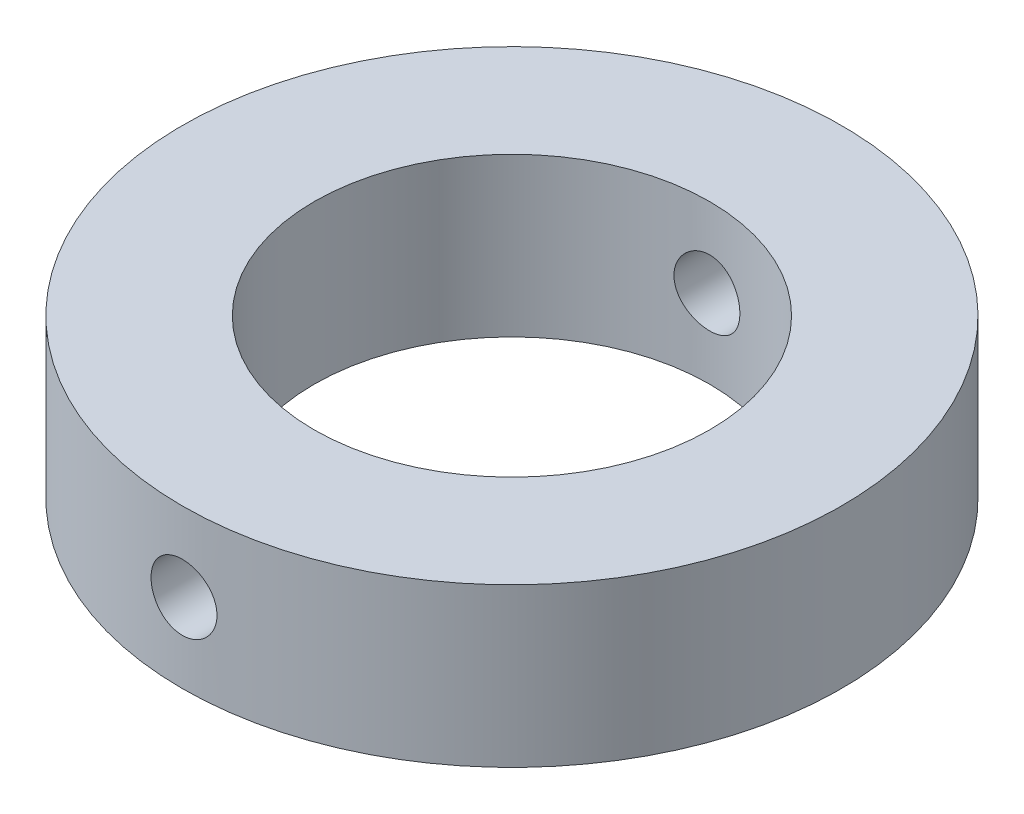
from build123d import *

# Parameters (mm, degrees)
SKETCH5_R               = 25
SKETCH5_R_2             = 15
BOSS_EXTRUDE2_DEPTH     = 12
CUT_EXTRUDE1_DEPTH      = 38.336309405
CUT_EXTRUDE1_DEPTH_BACK = 38.336309405
SKETCH6_R               = 2.5


with BuildPart() as part:
    # Sketch5 → Boss-Extrude2 (new body)
    with BuildSketch(Plane(origin=(0, 0, 0), x_dir=(1, 0, 0), z_dir=(0, 1, 0))):
        with Locations(Location((0, 0, 0), (0, 0, 270))):
            Circle(SKETCH5_R)
        with Locations(Location((0, 0, 0), (0, 0, 270))):
            Circle(SKETCH5_R_2, mode=Mode.SUBTRACT)
    extrude(amount=BOSS_EXTRUDE2_DEPTH)

    # Sketch6 → Cut-Extrude1 (cut, two sides: drawn at the far end of the back side and taken through both)
    with BuildSketch(Plane.XY.offset(-CUT_EXTRUDE1_DEPTH_BACK)):
        with Locations((0, 6)):
            Circle(SKETCH6_R)
    extrude(amount=CUT_EXTRUDE1_DEPTH + CUT_EXTRUDE1_DEPTH_BACK, mode=Mode.SUBTRACT)


solid = part.part
